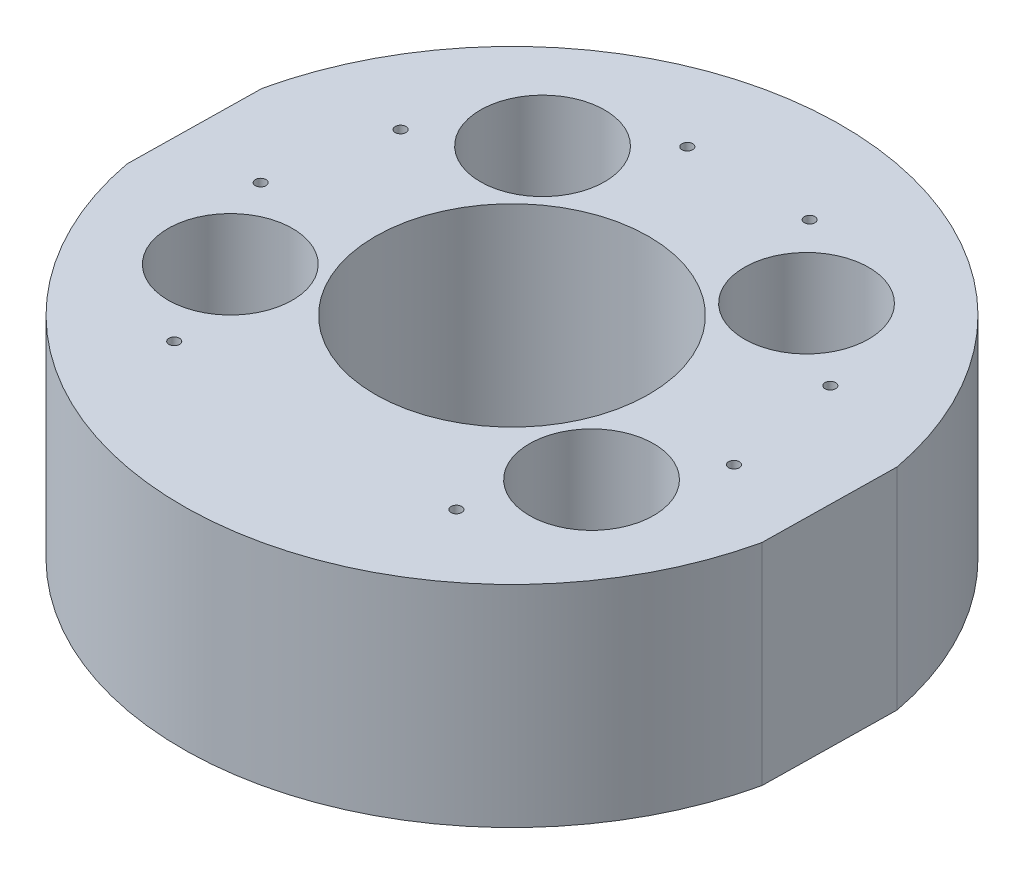
from build123d import *

# Parameters (mm, degrees)
SKETCH1_R           = 25.667
SKETCH1_R_2         = 11.666
BOSS_EXTRUDE1_DEPTH = 39.5
SKETCH3_R           = 1
CUT_EXTRUDE2_DEPTH  = 12


with BuildPart() as part:
    # Sketch1 → Boss-Extrude1 (new body)
    with BuildSketch(Plane(origin=(0, 0, 0), x_dir=(0.9998860245595665, 0, -0.015097612078275651), z_dir=(0, 1, 0))):
        with BuildLine():
            Line((-61.169473244, 13.237048576), (-61.945593174, -11.750901277))
            ThreePointArc((-61.945593174, -11.750901277), (-2.965804858, -62.923588573), (59.076056366, -15.509805654))
            Line((59.076056366, -15.509805654), (59.852176295, 9.478144199))
            ThreePointArc((59.852176295, 9.478144199), (0.872387979, 60.650831495), (-61.169473244, 13.237048576))
        make_face()
        with Locations(Location((-1.046708439, -1.136378539, 0), (0, 0, 269.134937682))):
            Circle(SKETCH1_R, mode=Mode.SUBTRACT)
        with Locations(Location((-25.270455744, 29.647637614, 0), (0, 0, 269.134937682))):
            Circle(SKETCH1_R_2, mode=Mode.SUBTRACT)
        with Locations(Location((25.040791951, 28.084981925, 0), (0, 0, 269.134937682))):
            Circle(SKETCH1_R_2, mode=Mode.SUBTRACT)
        with Locations(Location((32.795299128, -20.863621322, 0), (0, 0, 269.134937682))):
            Circle(SKETCH1_R_2, mode=Mode.SUBTRACT)
        with Locations(Location((-36.047749659, -18.725372188, 0), (0, 0, 269.134937682))):
            Circle(SKETCH1_R_2, mode=Mode.SUBTRACT)
    extrude(amount=BOSS_EXTRUDE1_DEPTH)

    # Sketch3 → Cut-Extrude2 (cut)
    with BuildSketch(Plane(origin=(-5.108058327, 40.5, 5.9056653), x_dir=(0.9998727759206764, 0, 0.01595092388174038), z_dir=(0, 1, 0))):
        with Locations(Location((-7.662813984, 48.486882974, 0), (0, 0, 180.913959377))):
            Circle(SKETCH3_R)
        with Locations(Location((15.667378709, 48.486882974, 0), (0, 0, 180.913959377))):
            Circle(SKETCH3_R)
        with Locations(Location((44.967394337, 23.920411988, 0), (0, 0, 180.913959377))):
            Circle(SKETCH3_R)
        with Locations(Location((49.120943166, 2.107633512, 0), (0, 0, 180.913959377))):
            Circle(SKETCH3_R)
        with Locations(Location((30.899804125, -31.507727626, 0), (0, 0, 180.913959377))):
            Circle(SKETCH3_R)
        with Locations(Location((-22.895239399, -31.507727626, 0), (0, 0, 180.913959377))):
            Circle(SKETCH3_R)
        with Locations(Location((-41.116378441, 2.107633512, 0), (0, 0, 180.913959377))):
            Circle(SKETCH3_R)
        with Locations(Location((-36.962829611, 23.920411988, 0), (0, 0, 180.913959377))):
            Circle(SKETCH3_R)
    extrude(amount=-CUT_EXTRUDE2_DEPTH, mode=Mode.SUBTRACT)


solid = part.part
